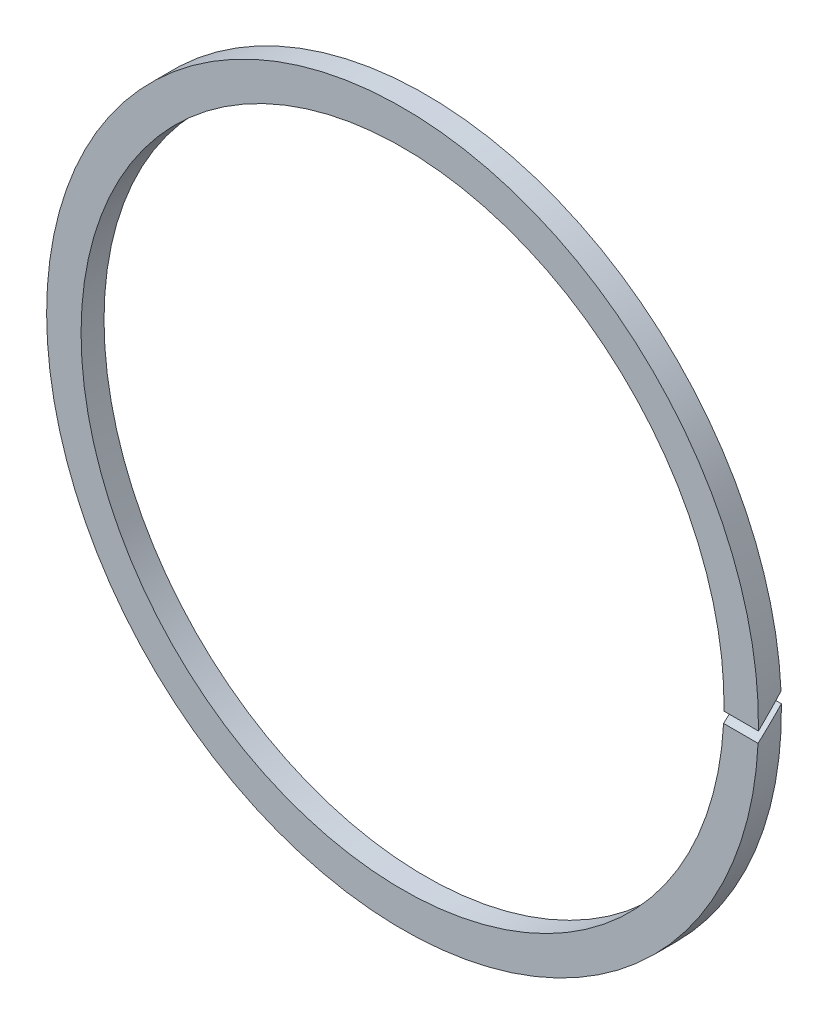
from build123d import *

# Parameters (mm, degrees)
SKETCH1_R           = 46.5
SKETCH1_R_2         = 42
BOSS_EXTRUDE1_DEPTH = 3
CUT_EXTRUDE1_DEPTH  = 53


with BuildPart() as part:
    # Sketch1 → Boss-Extrude1 (new body)
    with BuildSketch(Plane.XY):
        Circle(SKETCH1_R)
        Circle(SKETCH1_R_2, mode=Mode.SUBTRACT)
    extrude(amount=BOSS_EXTRUDE1_DEPTH)

    # Sketch2 → Cut-Extrude1 (cut)
    with BuildSketch(Plane(origin=(0, 0, 0), x_dir=(0, 0, -1), z_dir=(1, 0, 0))):
        Polygon((-13.214600476, -11.714163067), (-13.568153866, -11.360609677), (7.065800964, 9.273345153), (7.419354354, 8.919791762), (7.772907745, 8.566238372), (-12.861047085, -12.067716458), align=None)
    extrude(amount=CUT_EXTRUDE1_DEPTH, mode=Mode.SUBTRACT)


solid = part.part
